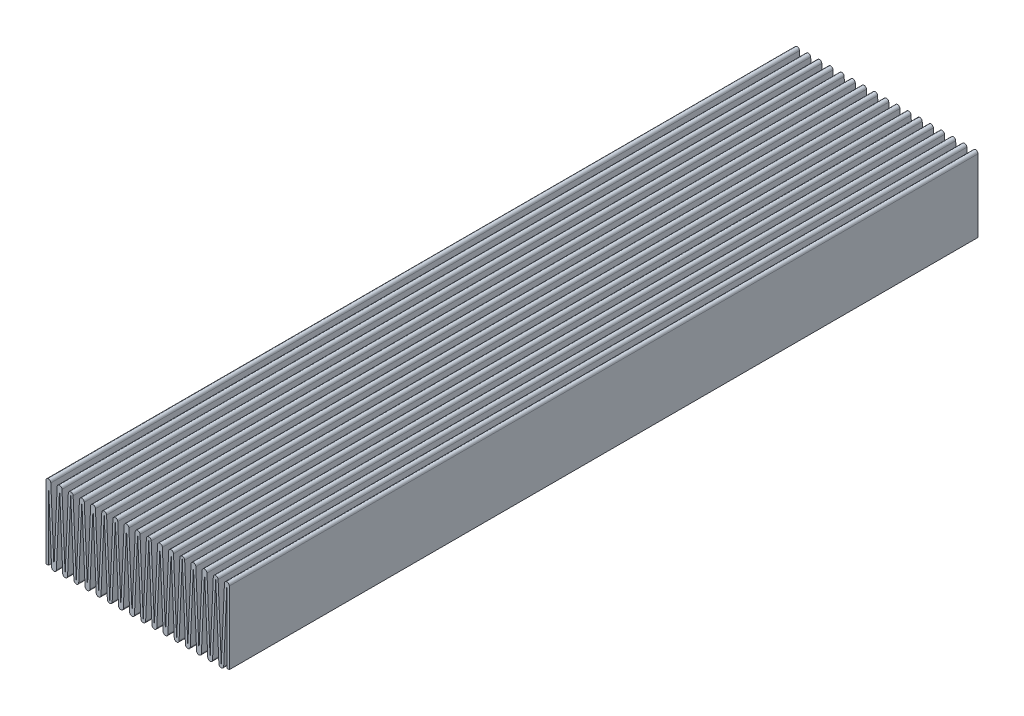
from build123d import *

# Parameters (mm, degrees)
EXTRUDE_4_DEPTH = 155


with BuildPart() as part:
    # 草图1 → 凸台-拉伸4 (new body)
    with BuildSketch(Plane.XY):
        with BuildLine():
            Line((1.654438254, 0.021809694), (0.999524111, 15.021809694))
            ThreePointArc((0.999524111, 15.021809694), (0.489092557, 15.499881014), (0, 15))
            Line((0, 15), (0, 0))
            Line((0, 0), (0.5, 0))
            Line((0.5, 0), (0.5, 15))
            Line((0.5, 15), (1.154914144, 0))
            ThreePointArc((1.154914144, 0), (1.654438254, -0.478190306), (2.153962365, 0))
            Line((2.153962365, 0), (2.808876509, 15))
            Line((2.808876509, 15), (3.463790652, 0))
            ThreePointArc((3.463790652, 0), (3.963314763, -0.478190306), (4.462838874, 0))
            Line((4.462838874, 0), (5.117753018, 15))
            Line((5.117753018, 15), (5.772667161, 0))
            ThreePointArc((5.772667161, 0), (6.272191272, -0.478190306), (6.771715383, 0))
            Line((6.771715383, 0), (7.426629527, 15))
            Line((7.426629527, 15), (8.08154367, 0))
            ThreePointArc((8.08154367, 0), (8.581067781, -0.478190306), (9.080591892, 0))
            Line((9.080591892, 0), (9.735506035, 15))
            Line((9.735506035, 15), (10.390420179, 0))
            ThreePointArc((10.390420179, 0), (10.88994429, -0.478190306), (11.389468401, 0))
            Line((11.389468401, 0), (12.044382544, 15))
            Line((12.044382544, 15), (12.699296688, 0))
            ThreePointArc((12.699296688, 0), (13.198820799, -0.478190306), (13.698344909, 0))
            Line((13.698344909, 0), (14.353259053, 15))
            Line((14.353259053, 15), (15.008173197, 0))
            ThreePointArc((15.008173197, 0), (15.507697307, -0.478190306), (16.007221418, 0))
            Line((16.007221418, 0), (16.662135562, 15))
            Line((16.662135562, 15), (17.317049705, 0))
            ThreePointArc((17.317049705, 0), (17.816573816, -0.478190306), (18.316097927, 0))
            Line((18.316097927, 0), (18.971012071, 15))
            Line((18.971012071, 15), (19.625926214, 0))
            ThreePointArc((19.625926214, 0), (20.125450325, -0.478190306), (20.624974436, 0))
            Line((20.624974436, 0), (21.27988858, 15))
            Line((21.27988858, 15), (21.934802723, 0))
            ThreePointArc((21.934802723, 0), (22.434326834, -0.478190306), (22.933850945, 0))
            Line((22.933850945, 0), (23.588765088, 15))
            Line((23.588765088, 15), (24.243679232, 0))
            ThreePointArc((24.243679232, 0), (24.743203343, -0.478190306), (25.242727454, 0))
            Line((25.242727454, 0), (25.897641597, 15))
            Line((25.897641597, 15), (26.552555741, 0))
            ThreePointArc((26.552555741, 0), (27.052079852, -0.478190306), (27.551603962, 0))
            Line((27.551603962, 0), (28.206518106, 15))
            Line((28.206518106, 15), (28.86143225, 0))
            ThreePointArc((28.86143225, 0), (29.36095636, -0.478190306), (29.860480471, 0))
            Line((29.860480471, 0), (30.515394615, 15))
            Line((30.515394615, 15), (31.170308759, 0))
            ThreePointArc((31.170308759, 0), (31.669832869, -0.478190306), (32.16935698, 0))
            Line((32.16935698, 0), (32.824271124, 15))
            Line((32.824271124, 15), (33.479185267, 0))
            ThreePointArc((33.479185267, 0), (33.978709378, -0.478190306), (34.478233489, 0))
            Line((34.478233489, 0), (35.133147633, 15))
            Line((35.133147633, 15), (35.788061776, 0))
            ThreePointArc((35.788061776, 0), (36.287585887, -0.478190306), (36.787109998, 0))
            Line((36.787109998, 0), (37.442024141, 15))
            Line((37.442024141, 15), (37.442024141, 0))
            Line((37.442024141, 0), (37.942024141, 0))
            Line((37.942024141, 0), (37.942024141, 15))
            ThreePointArc((37.942024141, 15), (37.452931584, 15.499881014), (36.942500031, 15.021809694))
            Line((36.942500031, 15.021809694), (36.287585887, 0.021809694))
            Line((36.287585887, 0.021809694), (35.632671743, 15.021809694))
            ThreePointArc((35.632671743, 15.021809694), (35.133147633, 15.5), (34.633623522, 15.021809694))
            Line((34.633623522, 15.021809694), (33.978709378, 0.021809694))
            Line((33.978709378, 0.021809694), (33.323795235, 15.021809694))
            ThreePointArc((33.323795235, 15.021809694), (32.824271124, 15.5), (32.324747013, 15.021809694))
            Line((32.324747013, 15.021809694), (31.669832869, 0.021809694))
            Line((31.669832869, 0.021809694), (31.014918726, 15.021809694))
            ThreePointArc((31.014918726, 15.021809694), (30.515394615, 15.5), (30.015870504, 15.021809694))
            Line((30.015870504, 15.021809694), (29.36095636, 0.021809694))
            Line((29.36095636, 0.021809694), (28.706042217, 15.021809694))
            ThreePointArc((28.706042217, 15.021809694), (28.206518106, 15.5), (27.706993995, 15.021809694))
            Line((27.706993995, 15.021809694), (27.052079852, 0.021809694))
            Line((27.052079852, 0.021809694), (26.397165708, 15.021809694))
            ThreePointArc((26.397165708, 15.021809694), (25.897641597, 15.5), (25.398117486, 15.021809694))
            Line((25.398117486, 15.021809694), (24.743203343, 0.021809694))
            Line((24.743203343, 0.021809694), (24.088289199, 15.021809694))
            ThreePointArc((24.088289199, 15.021809694), (23.588765088, 15.5), (23.089240978, 15.021809694))
            Line((23.089240978, 15.021809694), (22.434326834, 0.021809694))
            Line((22.434326834, 0.021809694), (21.77941269, 15.021809694))
            ThreePointArc((21.77941269, 15.021809694), (21.27988858, 15.5), (20.780364469, 15.021809694))
            Line((20.780364469, 15.021809694), (20.125450325, 0.021809694))
            Line((20.125450325, 0.021809694), (19.470536181, 15.021809694))
            ThreePointArc((19.470536181, 15.021809694), (18.971012071, 15.5), (18.47148796, 15.021809694))
            Line((18.47148796, 15.021809694), (17.816573816, 0.021809694))
            Line((17.816573816, 0.021809694), (17.161659673, 15.021809694))
            ThreePointArc((17.161659673, 15.021809694), (16.662135562, 15.5), (16.162611451, 15.021809694))
            Line((16.162611451, 15.021809694), (15.507697307, 0.021809694))
            Line((15.507697307, 0.021809694), (14.852783164, 15.021809694))
            ThreePointArc((14.852783164, 15.021809694), (14.353259053, 15.5), (13.853734942, 15.021809694))
            Line((13.853734942, 15.021809694), (13.198820799, 0.021809694))
            Line((13.198820799, 0.021809694), (12.543906655, 15.021809694))
            ThreePointArc((12.543906655, 15.021809694), (12.044382544, 15.5), (11.544858433, 15.021809694))
            Line((11.544858433, 15.021809694), (10.88994429, 0.021809694))
            Line((10.88994429, 0.021809694), (10.235030146, 15.021809694))
            ThreePointArc((10.235030146, 15.021809694), (9.735506035, 15.5), (9.235981925, 15.021809694))
            Line((9.235981925, 15.021809694), (8.581067781, 0.021809694))
            Line((8.581067781, 0.021809694), (7.926153637, 15.021809694))
            ThreePointArc((7.926153637, 15.021809694), (7.426629527, 15.5), (6.927105416, 15.021809694))
            Line((6.927105416, 15.021809694), (6.272191272, 0.021809694))
            Line((6.272191272, 0.021809694), (5.617277128, 15.021809694))
            ThreePointArc((5.617277128, 15.021809694), (5.117753018, 15.5), (4.618228907, 15.021809694))
            Line((4.618228907, 15.021809694), (3.963314763, 0.021809694))
            Line((3.963314763, 0.021809694), (3.30840062, 15.021809694))
            ThreePointArc((3.30840062, 15.021809694), (2.808876509, 15.5), (2.309352398, 15.021809694))
            Line((2.309352398, 15.021809694), (1.654438254, 0.021809694))
        make_face()
    extrude(amount=EXTRUDE_4_DEPTH)


solid = part.part
